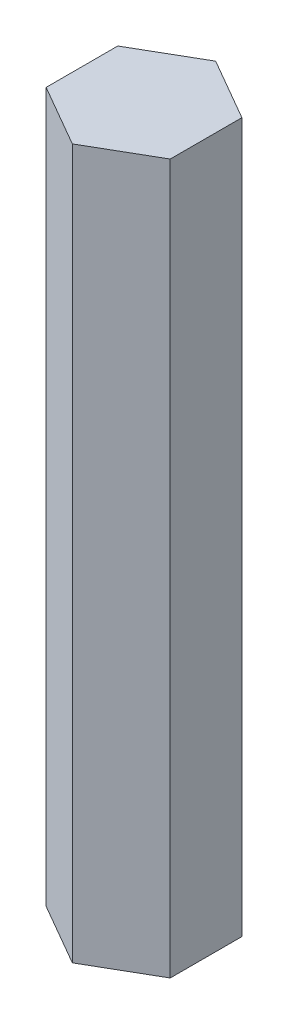
from build123d import *

# Parameters (mm, degrees)
EXTRUDE_1_DEPTH = 40


with BuildPart() as part:
    # Эскиз1 → Бобышка-Вытянуть1 (new body)
    with BuildSketch(Plane(origin=(0, 0, 0), x_dir=(1, 0, 0), z_dir=(0, 1, 0))):
        Polygon((0, 4.041451884), (-3.5, 2.020725942), (-3.5, -2.020725942), (0, -4.041451884), (3.5, -2.020725942), (3.5, 2.020725942), align=None)
    extrude(amount=EXTRUDE_1_DEPTH)


solid = part.part
